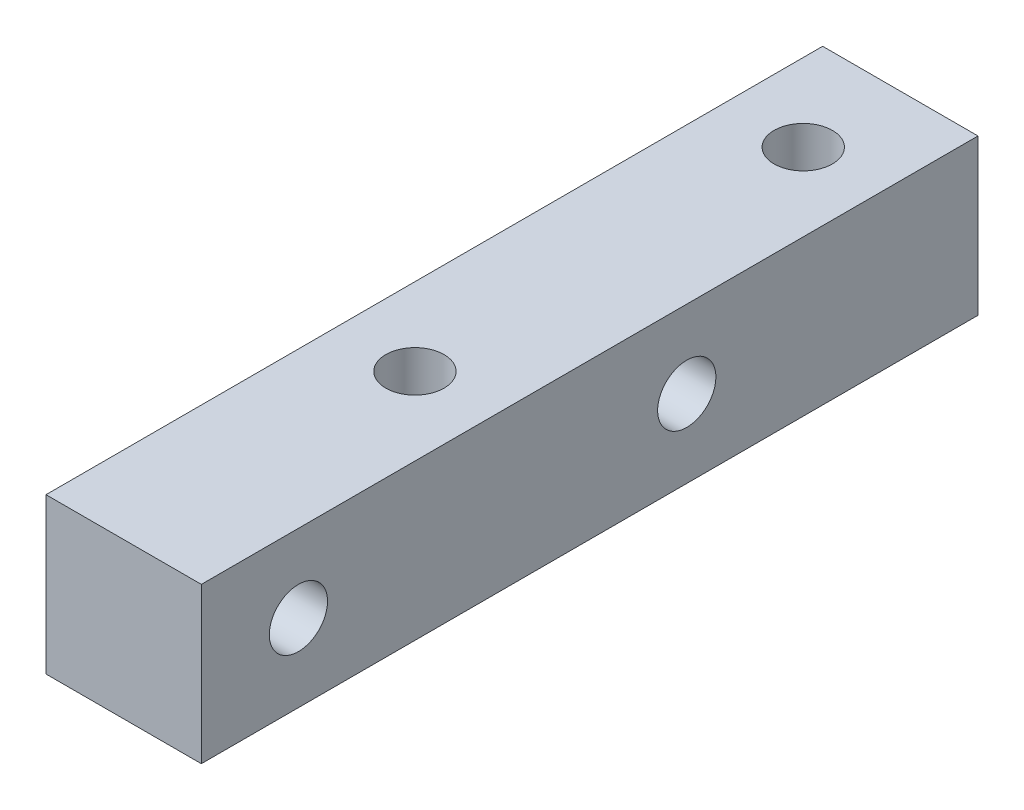
from build123d import *

# Parameters (mm, degrees)
SKETCH_1_W          = 8
SKETCH_1_H          = 8
EXTRUDE_1_DEPTH     = 20
CUT_EXTRUDE_1_REACH = 23.909
SKETCH_2_R          = 1.5
CUT_EXTRUDE_2_REACH = 23.909
SKETCH_3_R          = 1.5


with BuildPart() as part:
    # 草图1 → 凸台-拉伸1 (new, symmetric)
    with BuildSketch(Plane.XY):
        Rectangle(SKETCH_1_W, SKETCH_1_H)
    extrude(amount=EXTRUDE_1_DEPTH, both=True)

    # 草图2 → 切除-拉伸1 (cut, up to next)
    with BuildSketch(Plane(origin=(4, 0, 0), x_dir=(0, 0, -1), z_dir=(1, 0, 0)), mode=Mode.PRIVATE) as cut_extrude_1_sk1:
        with Locations(Location((-15, 0, 0), (0, 0, 90))):
            Circle(SKETCH_2_R)
    cut_extrude_1_tool1 = extrude(cut_extrude_1_sk1.sketch, amount=-CUT_EXTRUDE_1_REACH, mode=Mode.PRIVATE) & part.part
    # 草图2 → 切除-拉伸1 (cut, up to next)
    with BuildSketch(Plane(origin=(4, 0, 0), x_dir=(0, 0, -1), z_dir=(1, 0, 0)), mode=Mode.PRIVATE) as cut_extrude_1_sk2:
        with Locations(Location((5, 0, 0), (0, 0, 90))):
            Circle(SKETCH_2_R)
    cut_extrude_1_tool2 = extrude(cut_extrude_1_sk2.sketch, amount=-CUT_EXTRUDE_1_REACH, mode=Mode.PRIVATE) & part.part
    add(cut_extrude_1_tool1.solids().sort_by_distance((4, 0, 15))[0], mode=Mode.SUBTRACT)
    add(cut_extrude_1_tool2.solids().sort_by_distance((4, 0, -5))[0], mode=Mode.SUBTRACT)

    # 草图3 → 切除-拉伸2 (cut, up to next)
    with BuildSketch(Plane(origin=(0, 4, 0), x_dir=(1, 0, 0), z_dir=(0, 1, 0)), mode=Mode.PRIVATE) as cut_extrude_2_sk1:
        with Locations(Location((0, 15, 0), (0, 0, 270))):
            Circle(SKETCH_3_R)
    cut_extrude_2_tool1 = extrude(cut_extrude_2_sk1.sketch, amount=-CUT_EXTRUDE_2_REACH, mode=Mode.PRIVATE) & part.part
    # 草图3 → 切除-拉伸2 (cut, up to next)
    with BuildSketch(Plane(origin=(0, 4, 0), x_dir=(1, 0, 0), z_dir=(0, 1, 0)), mode=Mode.PRIVATE) as cut_extrude_2_sk2:
        with Locations(Location((0, -5, 0), (0, 0, 270))):
            Circle(SKETCH_3_R)
    cut_extrude_2_tool2 = extrude(cut_extrude_2_sk2.sketch, amount=-CUT_EXTRUDE_2_REACH, mode=Mode.PRIVATE) & part.part
    add(cut_extrude_2_tool1.solids().sort_by_distance((0, 4, -15))[0], mode=Mode.SUBTRACT)
    add(cut_extrude_2_tool2.solids().sort_by_distance((0, 4, 5))[0], mode=Mode.SUBTRACT)


solid = part.part
